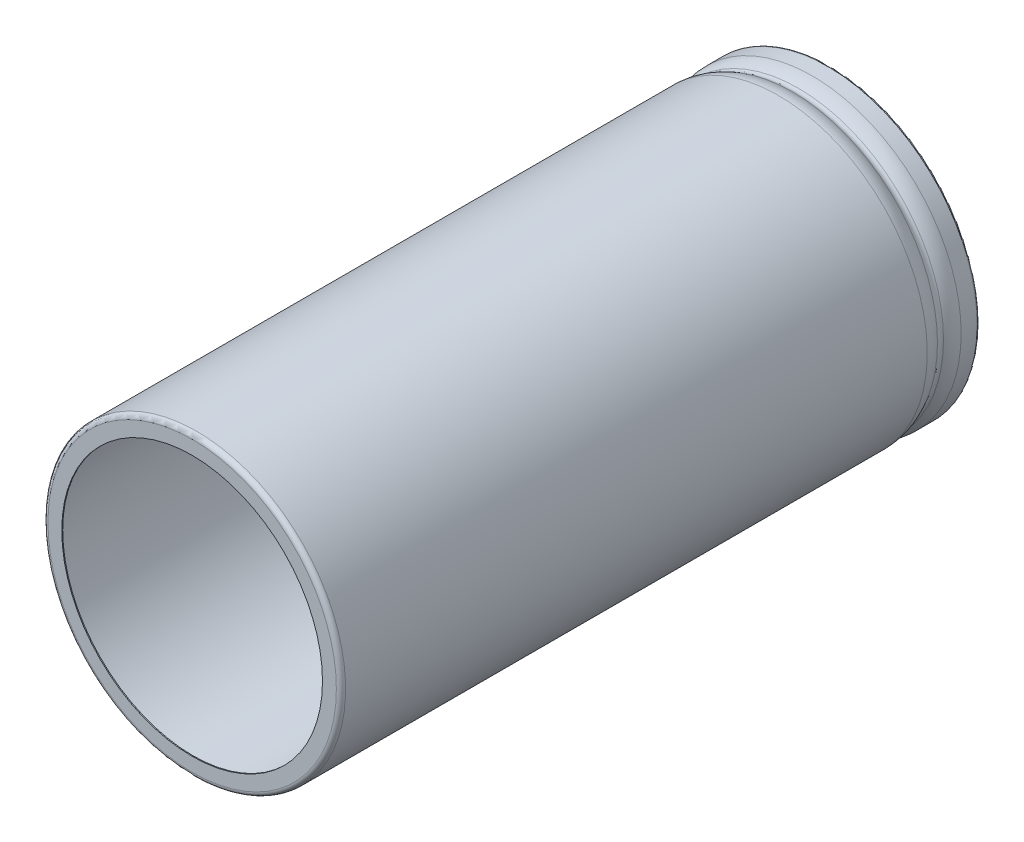
from build123d import *

# Parameters (mm, degrees)
FILLET1_R = 0.25
FILLET2_R = 0.5
FILLET3_R = 3


with BuildPart() as part:
    # Sketch1 → Revolve1 (revolve)
    with BuildSketch(Plane(origin=(0, 0, 0), x_dir=(0, 0, -1), z_dir=(1, 0, 0)), mode=Mode.PRIVATE) as revolve1_sk:
        with BuildLine():
            Line((0, 14.1), (-0.1, 14.1))
            Line((-0.1, 14.1), (-0.1, 16.1))
            Line((-0.1, 16.1), (64.4, 16.1))
            add(Edge.make_bspline(
                [(64.4, 16.1), (65.15, 15.1), (65.9, 16.1)],
                knots=[0, 0, 0, 1, 1, 1], degree=2))
            Line((65.9, 16.1), (68.95, 16.1))
            Line((68.95, 16.1), (68.95, 13.1))
            Line((68.95, 13.1), (68.9, 13.1))
            Line((68.9, 13.1), (68.9, 16))
            Line((68.9, 16), (65.9, 16))
            add(Edge.make_bspline(
                [(64.4, 16), (65.15, 15), (65.9, 16)],
                knots=[0, 0, 0, 1, 1, 1], degree=2))
            Line((64.4, 16), (0, 16))
            Line((0, 16), (0, 14.1))
        make_face()
    revolve(revolve1_sk.sketch.rotate(Axis((0, 0, 0), (0, 0, -1)), 90), axis=Axis((0, 0, 0), (0, 0, -1)))

    # Fillet1
    fillet1_edges = [part.edges().sort_by_distance(p)[0] for p in [
        (-16.1, 0, -68.95),
        (-16, 0, -68.9),
    ]]
    fillet(fillet1_edges, radius=FILLET1_R)

    # Fillet2
    fillet2_edges = [part.edges().sort_by_distance(p)[0] for p in [
        (-16.1, 0, 0.1),
        (-16, 0, 0),
    ]]
    fillet(fillet2_edges, radius=FILLET2_R)

    # Fillet3
    fillet3_edges = [part.edges().sort_by_distance(p)[0] for p in [
        (-16.1, 0, -65.9),
        (-16.1, 0, -64.4),
        (-16, 0, -64.4),
        (-16, 0, -65.9),
    ]]
    fillet(fillet3_edges, radius=FILLET3_R)


solid = part.part
